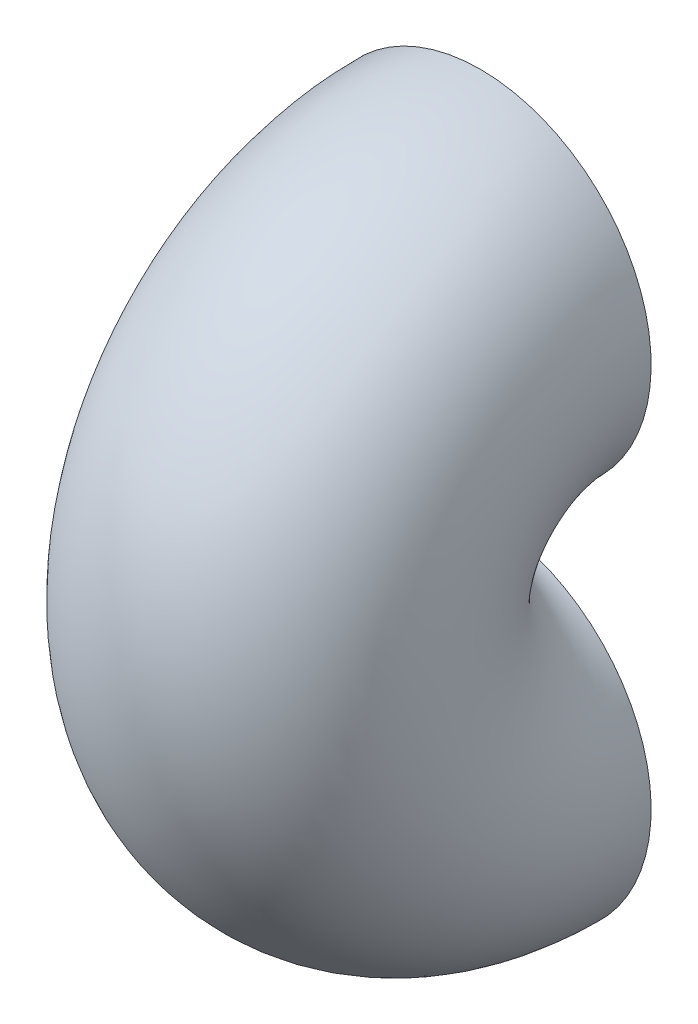
from build123d import *

# Parameters (mm, degrees)
ESQUISSE1_R       = 35.5
ESQUISSE1_R_2     = 32.5
R_VOLUTION1_ANGLE = 180


with BuildPart() as part:
    # Esquisse1 → Révolution1 (revolve)
    with BuildSketch(Plane.XY):
        Circle(ESQUISSE1_R)
        Circle(ESQUISSE1_R_2, mode=Mode.SUBTRACT)
    revolve(axis=Axis((-314.903059277, -40, 0), (1, 0, 0)), revolution_arc=R_VOLUTION1_ANGLE)


solid = part.part
